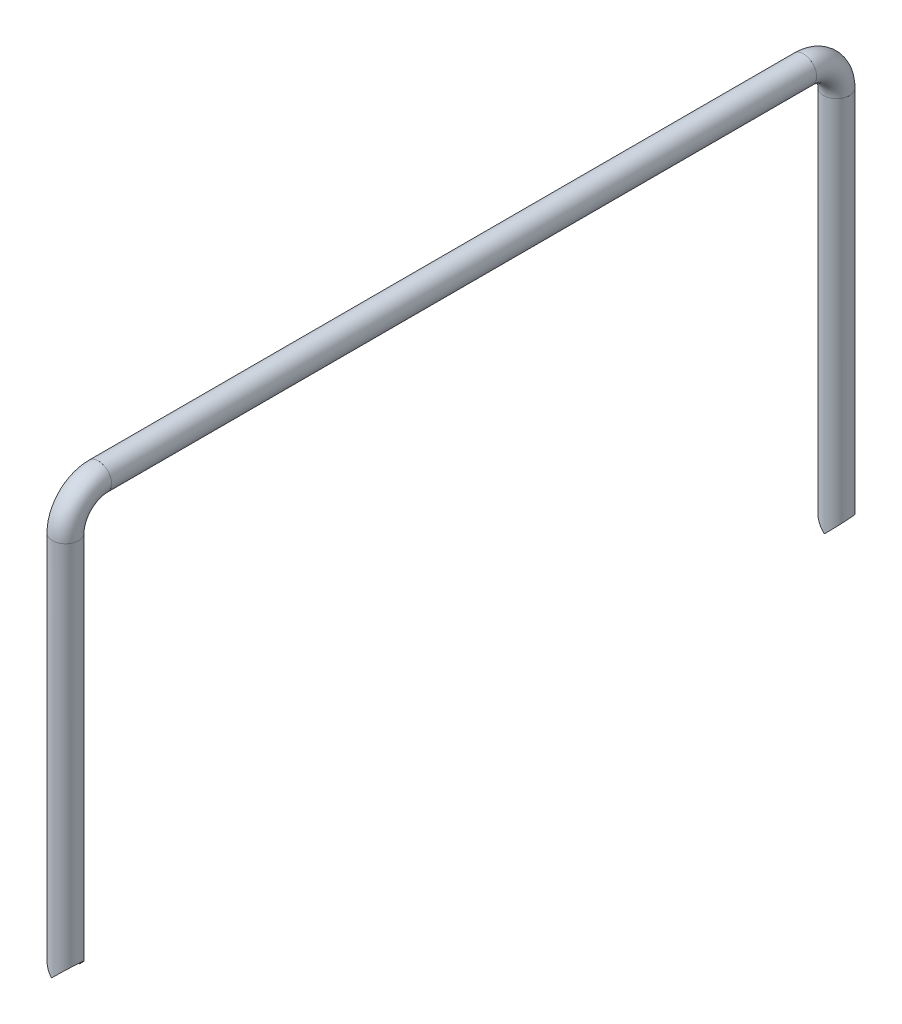
from build123d import *

# Parameters (mm, degrees)
SKETCH1_R                            = 7.9375
SKETCH1_R_2                          = 6.4375
PIPE_CONFIGURED_21_3_X_2_3_1_DEPTH   = 230
SKETCH1_ON_SEGMENT_2_R               = 7.9375
SKETCH1_ON_SEGMENT_2_R_2             = 6.4375
PIPE_CONFIGURED_21_3_X_2_3_1_2_ANGLE = 90
SKETCH1_ON_SEGMENT_3_R               = 7.9375
SKETCH1_ON_SEGMENT_3_R_2             = 6.4375
PIPE_CONFIGURED_21_3_X_2_3_1_3_DEPTH = 427.653579857
SKETCH1_ON_SEGMENT_4_R               = 7.9375
SKETCH1_ON_SEGMENT_4_R_2             = 6.4375
PIPE_CONFIGURED_21_3_X_2_3_1_4_ANGLE = 90
SKETCH1_ON_SEGMENT_5_R               = 7.9375
SKETCH1_ON_SEGMENT_5_R_2             = 6.4375
PIPE_CONFIGURED_21_3_X_2_3_1_5_DEPTH = 230
ESBO_O6_R                            = 7.9375


with BuildPart() as part:
    # Sketch1 → Pipe - configured 21.3 X 2.3(1) (new body)
    with BuildSketch(Plane(origin=(473.575059, 0, 233.826789929), x_dir=(1, 0, 0), z_dir=(0, 1, 0))):
        Circle(SKETCH1_R)
        Circle(SKETCH1_R_2, mode=Mode.SUBTRACT)
    extrude(amount=PIPE_CONFIGURED_21_3_X_2_3_1_DEPTH)


with BuildPart() as body_2:
    # Sketch1 on segment 2 (carried to the start of arc 2) → Pipe - configured 21.3 X 2.3_1 2 (revolve)
    with BuildSketch(Plane(origin=(473.575059, 230, 233.826789929), x_dir=(1, 0, 0), z_dir=(0, 1, 0))):
        Circle(SKETCH1_ON_SEGMENT_2_R)
        Circle(SKETCH1_ON_SEGMENT_2_R_2, mode=Mode.SUBTRACT)
    revolve(axis=Axis((473.575059, 230, 213.826789929), (-1, 0, 0)), revolution_arc=PIPE_CONFIGURED_21_3_X_2_3_1_2_ANGLE)


with BuildPart() as body_3:
    # Sketch1 on segment 3 (carried to segment 3) → Pipe - configured 21.3 X 2.3_1 3 (new body)
    with BuildSketch(Plane(origin=(473.575059, 250, 213.826789929), x_dir=(1, 0, 0), z_dir=(0, 0, -1))):
        Circle(SKETCH1_ON_SEGMENT_3_R)
        Circle(SKETCH1_ON_SEGMENT_3_R_2, mode=Mode.SUBTRACT)
    extrude(amount=PIPE_CONFIGURED_21_3_X_2_3_1_3_DEPTH)


with BuildPart() as body_4:
    # Sketch1 on segment 4 (carried to the start of arc 4) → Pipe - configured 21.3 X 2.3_1 4 (revolve)
    with BuildSketch(Plane(origin=(473.575059, 250, -213.826789929), x_dir=(1, 0, 0), z_dir=(0, 0, -1))):
        Circle(SKETCH1_ON_SEGMENT_4_R)
        Circle(SKETCH1_ON_SEGMENT_4_R_2, mode=Mode.SUBTRACT)
    revolve(axis=Axis((473.575059, 230, -213.826789929), (-1, 0, 0)), revolution_arc=PIPE_CONFIGURED_21_3_X_2_3_1_4_ANGLE)


with BuildPart() as body_5:
    # Sketch1 on segment 5 (carried to segment 5) → Pipe - configured 21.3 X 2.3_1 5 (new body)
    with BuildSketch(Plane(origin=(473.575059, 0, -233.826789929), x_dir=(1, 0, 0), z_dir=(0, 1, 0))):
        Circle(SKETCH1_ON_SEGMENT_5_R)
        Circle(SKETCH1_ON_SEGMENT_5_R_2, mode=Mode.SUBTRACT)
    extrude(amount=PIPE_CONFIGURED_21_3_X_2_3_1_5_DEPTH)


with BuildPart() as varredura_de_corte1_tool:
    # Varredura de corte1: sweep along a path in Esboço1
    with BuildLine(Plane(origin=(0, 0, 0), x_dir=(1, 0, 0), z_dir=(0, 1, 0))) as varredura_de_corte1_path:
        Line((910, 265), (37.150118, 202.653579857))
        ThreePointArc((37.150118, 202.653579857), (10.725477972, 190.013301495), (0, 162.755231864))
        Line((0, 162.755231864), (0, -162.755231864))
        ThreePointArc((0, -162.755231864), (10.725477972, -190.013301495), (37.150118, -202.653579857))
        Line((37.150118, -202.653579857), (910, -265))
    # Esboço6 → Varredura de corte1 (sweep)
    with BuildSketch(Plane.XY):
        Circle(ESBO_O6_R)
    sweep(path=varredura_de_corte1_path.line)


with BuildPart() as part_1:
    add(part.part)

    # Varredura de corte1: cut by varredura_de_corte1_tool
    add(varredura_de_corte1_tool.part, mode=Mode.SUBTRACT)


with BuildPart() as body_5_1:
    add(body_5.part)

    # Varredura de corte1: cut by varredura_de_corte1_tool
    add(varredura_de_corte1_tool.part, mode=Mode.SUBTRACT)


solid = Compound([body_2.part, body_3.part, body_4.part, part_1.part, body_5_1.part])
